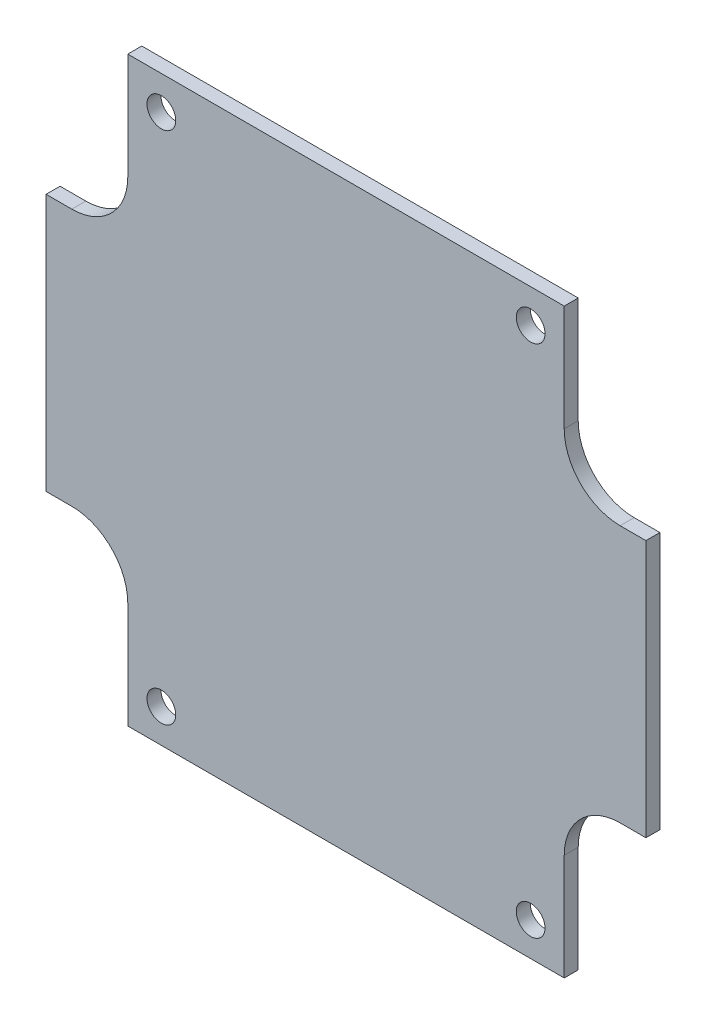
from build123d import *

# Parameters (mm, degrees)
BOSS_EXTRUDE1_DEPTH = 1.5875
SKETCH3_R           = 1.63195
CUT_EXTRUDE1_DEPTH  = 95.855674265


with BuildPart() as part:
    # Sketch1 → Boss-Extrude1 (new body)
    with BuildSketch(Plane.XY):
        with BuildLine():
            Line((0, 47.625), (0, 18.415))
            Line((0, 18.415), (2.921, 18.415))
            ThreePointArc((2.921, 18.415), (7.411128061, 16.555128061), (9.271, 12.065))
            Line((9.271, 12.065), (9.271, 0))
            Line((9.271, 0), (58.801, 0))
            Line((58.801, 0), (58.801, 12.065))
            ThreePointArc((58.801, 12.065), (60.660871939, 16.555128061), (65.151, 18.415))
            Line((65.151, 18.415), (68.072, 18.415))
            Line((68.072, 18.415), (68.072, 47.625))
            Line((68.072, 47.625), (65.151, 47.625))
            ThreePointArc((65.151, 47.625), (60.660871939, 49.484871939), (58.801, 53.975))
            Line((58.801, 53.975), (58.801, 66.04))
            Line((58.801, 66.04), (9.271, 66.04))
            Line((9.271, 66.04), (9.271, 53.975))
            ThreePointArc((9.271, 53.975), (7.411128061, 49.484871939), (2.921, 47.625))
            Line((2.921, 47.625), (0, 47.625))
        make_face()
    extrude(amount=BOSS_EXTRUDE1_DEPTH)

    # Sketch3 → Cut-Extrude1 (cut, through all)
    with BuildSketch(Plane.XY.offset(1.5875)):
        with Locations((54.991, 62.23)):
            Circle(SKETCH3_R)
        with Locations((54.991, 3.81)):
            Circle(SKETCH3_R)
        with Locations((13.081, 3.81)):
            Circle(SKETCH3_R)
        with Locations((13.081, 62.23)):
            Circle(SKETCH3_R)
    extrude(amount=-CUT_EXTRUDE1_DEPTH, mode=Mode.SUBTRACT)


solid = part.part
